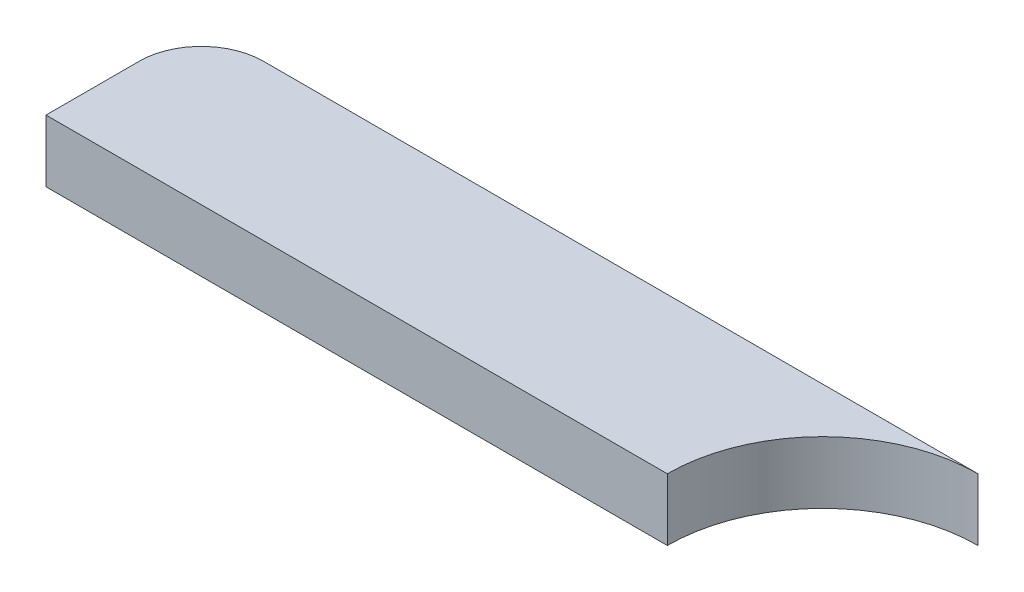
from build123d import *

# Parameters (mm, degrees)
BOSS_EXTRUDE1_DEPTH = 2
FILLET1_R           = 2


with BuildPart() as part:
    # Sketch1 → Boss-Extrude1 (new body)
    with BuildSketch(Plane(origin=(0, 0, 0), x_dir=(1, 0, 0), z_dir=(0, 1, 0))):
        with BuildLine():
            Line((0, 5), (-25, 5))
            Line((-25, 5), (-25, 0))
            Line((-25, 0), (-5, 0))
            ThreePointArc((-5, 0), (-3.535533906, 3.535533906), (0, 5))
        make_face()
    extrude(amount=BOSS_EXTRUDE1_DEPTH)

    # Fillet1
    fillet1_edges = [part.edges().sort_by_distance(p)[0] for p in [
        (-25, 1, -5),
    ]]
    fillet(fillet1_edges, radius=FILLET1_R)


solid = part.part
